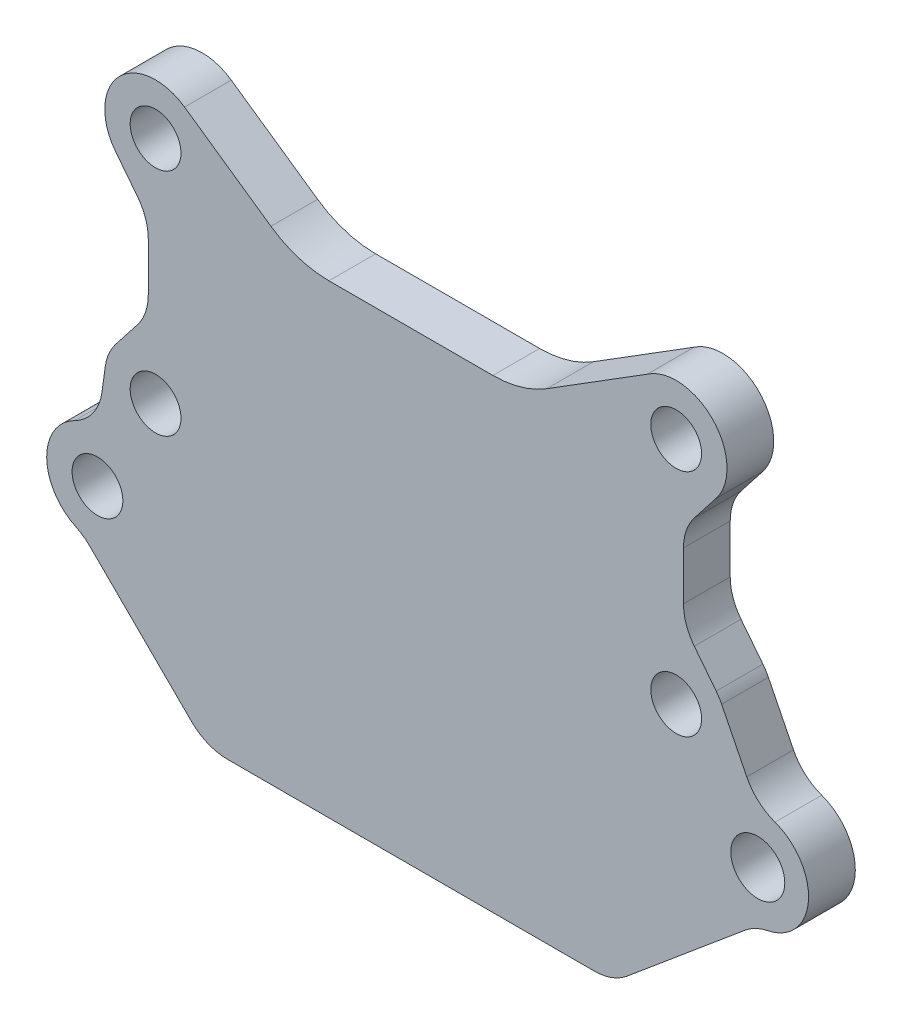
from build123d import *

# Parameters (mm, degrees)
SKETCH1_R           = 3.1750000000000016
SKETCH1_R_2         = 3.174999999999998
SKETCH1_R_3         = 3.1749999999999976
BOSS_EXTRUDE1_DEPTH = 5.842
FILLET1_R           = 6.35
FILLET2_R           = 12.7
BOSS_EXTRUDE2_START = -5.842
SKETCH2_R           = 3.3749999999999933
BOSS_EXTRUDE2_DEPTH = 5.842
SKETCH3_R           = 3.174229815615873
CUT_EXTRUDE1_DEPTH  = 74.47150684282778
FILLET3_R           = 6.35
CUT_EXTRUDE2_DEPTH  = 74.47150698753184
FILLET4_R           = 6.35


with BuildPart() as part:
    # Sketch1 → Boss-Extrude1 (new body)
    with BuildSketch(Plane.XY):
        with BuildLine():
            Line((-19.735202783136515, 15.926469991088537), (-23.82219128055887, 21.14411855360569))
            ThreePointArc((-23.82219128055887, 21.14411855360569), (-23.43878883536159, 29.420896018239304), (-15.19702887852625, 30.27262100199607))
            Line((-15.19702887852625, 30.27262100199607), (-1.1351215821202347, 20.490721215283713))
            Line((-1.1351215821202347, 20.490721215283713), (26.98869301069201, 20.49072121528371))
            Line((26.98869301069201, 20.49072121528371), (42.6381003070978, 30.272621001996075))
            ThreePointArc((42.6381003070978, 30.272621001996075), (50.87986026393313, 29.42089601823929), (51.26326270913039, 21.14411855360571))
            Line((51.26326270913039, 21.14411855360571), (47.176274211707955, 15.926469991088574))
            Line((47.176274211707955, 15.926469991088574), (47.176274211707955, 5.491172866054349))
            Line((47.176274211707955, 5.491172866054349), (51.26326270913039, 0.27352430353700524))
            ThreePointArc((51.26326270913039, 0.27352430353700524), (52.26703524751068, -1.5710682312081294), (52.614285714285785, -3.6421785714286505))
            Line((52.614285714285785, -3.6421785714286505), (52.614285714285785, -37.659455709821316))
            Line((52.614285714285785, -37.659455709821316), (-25.173214285713918, -37.659455709821316))
            Line((-25.173214285713918, -37.659455709821316), (-25.173214285713925, -3.6421785714286505))
            ThreePointArc((-25.173214285713925, -3.6421785714286505), (-24.825963818939076, -1.5710682312081503), (-23.822191280558854, 0.27352430353699286))
            Line((-23.822191280558854, 0.27352430353699286), (-19.735202783136522, 5.491172866054132))
            Line((-19.735202783136522, 5.491172866054132), (-19.735202783136515, 15.926469991088537))
        make_face()
        with Locations((-18.823214285714226, 25.059821428571347)):
            Circle(SKETCH1_R, mode=Mode.SUBTRACT)
        with Locations((46.26428571428577, 25.059821428571347)):
            Circle(SKETCH1_R_2, mode=Mode.SUBTRACT)
        with Locations((46.26428571428577, -3.6421785714286505)):
            Circle(SKETCH1_R_3, mode=Mode.SUBTRACT)
        with Locations((-18.823214285713924, -3.6421785714286505)):
            Circle(SKETCH1_R, mode=Mode.SUBTRACT)
    extrude(amount=BOSS_EXTRUDE1_DEPTH)

    # Fillet1
    fillet1_edges = [part.edges().sort_by_distance(p)[0] for p in [
        (47.176274211707955, 15.926469991088574, 2.921),
        (47.176274211707955, 5.491172866054349, 2.921),
        (-19.735202783136522, 5.491172866054132, 2.921),
        (-19.735202783136515, 15.926469991088537, 2.921),
    ]]
    fillet(fillet1_edges, radius=FILLET1_R)

    # Fillet2
    fillet2_edges = [part.edges().sort_by_distance(p)[0] for p in [
        (-1.1351215821202347, 20.490721215283713, 2.921),
        (26.98869301069201, 20.49072121528371, 2.921),
    ]]
    fillet(fillet2_edges, radius=FILLET2_R)

    # Sketch2 → Boss-Extrude2 (add)
    # profile 1 of 2: a face of its own
    with BuildSketch(Plane.XY.offset(5.842).offset(BOSS_EXTRUDE2_START)):
        with BuildLine():
            Line((52.614285714285785, -22.564372384825948), (56.4647972168636, -22.564372384825948))
            ThreePointArc((56.4647972168636, -22.564372384825948), (62.8147972168636, -16.214372384825946), (56.4647972168636, -9.864372384825945))
            Line((56.4647972168636, -9.864372384825945), (51.94643033410118, -0.8074418077232544))
            ThreePointArc((51.94643033410118, -0.8074418077232544), (52.44506715095817, -2.186005219081439), (52.614285714285785, -3.6421785714286505))
            Line((52.614285714285785, -3.6421785714286505), (52.614285714285785, -11.165009933138013))
            Line((52.614285714285785, -11.165009933138013), (52.614285714285785, -21.26373483651388))
            Line((52.614285714285785, -21.26373483651388), (52.614285714285785, -22.564372384825948))
        make_face()
        with Locations((56.4647972168636, -16.214372384825946)):
            Circle(SKETCH2_R, mode=Mode.SUBTRACT)
    # profile 2 of 2: a face of its own
    with BuildSketch(Plane.XY.offset(5.842).offset(BOSS_EXTRUDE2_START)):
        with BuildLine():
            Line((-25.11442078188718, -2.7800760122689354), (-26.085202783136417, -9.864372384825948))
            ThreePointArc((-26.085202783136417, -9.864372384825948), (-32.43520278313642, -16.21437238482595), (-26.085202783136413, -22.56437238482595))
            Line((-26.085202783136417, -22.56437238482595), (-25.17321428571397, -22.56437238482595))
            Line((-25.17321428571397, -22.56437238482595), (-25.17321428571397, -22.49854114294895))
            Line((-25.173214285713975, -22.49854114294895), (-25.173214285713986, -19.254769053504887))
            ThreePointArc((-25.173214285713996, -19.254769053504887), (-29.25943259875229, -16.214372384825957), (-25.17321428571401, -13.173975716147009))
            Line((-25.173214285714007, -13.173975716147009), (-25.17321428571402, -9.930203626702937))
            Line((-25.17321428571402, -9.930203626702937), (-25.173214285714042, -3.6421785714286496))
            ThreePointArc((-25.173214285714042, -3.6421785714286496), (-25.158498859065922, -3.2101260576638357), (-25.11442078188718, -2.7800760122689354))
        make_face()
    extrude(amount=BOSS_EXTRUDE2_DEPTH)

    # Sketch3 → Cut-Extrude1 (cut, through all)
    with BuildSketch(Plane.XY.offset(5.842)):
        with Locations((-26.085202783136417, -16.21437238482595)):
            Circle(SKETCH3_R)
    extrude(amount=-CUT_EXTRUDE1_DEPTH, mode=Mode.SUBTRACT)

    # Fillet3
    fillet3_edges = [part.edges().sort_by_distance(p)[0] for p in [
        (56.4647972168636, -9.864372384825945, 2.921),
        (52.614285714285785, -22.564372384825948, 2.921),
        (-25.17321428571397, -22.56437238482595, 2.921),
        (-26.085202783136417, -9.864372384825948, 2.921),
    ]]
    fillet(fillet3_edges, radius=FILLET3_R)

    # Sketch4 → Cut-Extrude2 (cut, through all)
    with BuildSketch(Plane.XY.offset(5.842)):
        with BuildLine():
            Line((-25.173214285713918, -37.659455709821316), (-12.473214285713917, -37.659455709821316))
            Line((-12.473214285713917, -37.659455709821316), (-27.048811913081487, -23.185421123073148))
            ThreePointArc((-27.048811913081487, -23.185421123073148), (-25.66083613916725, -25.250928515915028), (-25.17321428571392, -27.691219987623278))
            Line((-25.17321428571392, -27.691219987623278), (-25.173214285713918, -37.659455709821316))
        make_face()
        with BuildLine():
            Line((54.888473112152276, -23.796663637650127), (38.326785714286075, -37.659455709821316))
            Line((38.326785714286075, -37.659455709821316), (52.614285714285785, -37.659455709821316))
            Line((52.614285714285785, -37.659455709821316), (52.614285714285785, -28.665981005853762))
            ThreePointArc((52.614285714285785, -28.665981005853762), (53.21085586664066, -25.97887382745055), (54.888473112152276, -23.796663637650127))
        make_face()
    extrude(amount=-CUT_EXTRUDE2_DEPTH, mode=Mode.SUBTRACT)

    # Fillet4
    fillet4_edges = [part.edges().sort_by_distance(p)[0] for p in [
        (-12.473214285713917, -37.659455709821316, 2.921),
        (38.326785714286075, -37.659455709821316, 2.921),
    ]]
    fillet(fillet4_edges, radius=FILLET4_R)


solid = part.part
